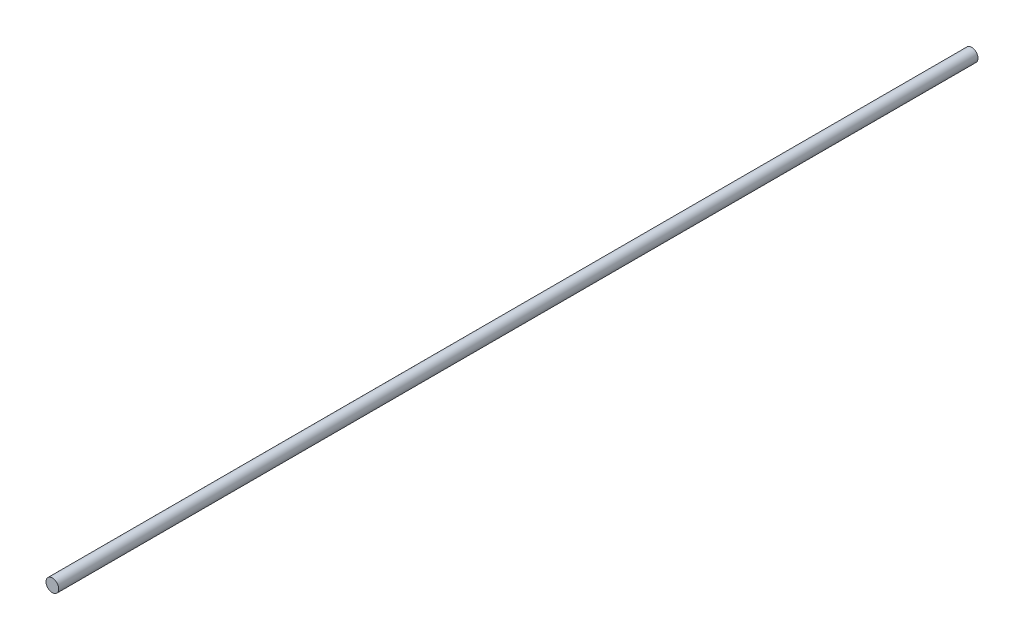
from build123d import *

# Parameters (mm, degrees)
SKETCH1_R           = 3.175
BOSS_EXTRUDE1_DEPTH = 228.6


with BuildPart() as part:
    # Sketch1 → Boss-Extrude1 (new, symmetric)
    with BuildSketch(Plane.XY):
        Circle(SKETCH1_R)
    extrude(amount=BOSS_EXTRUDE1_DEPTH, both=True)


solid = part.part
